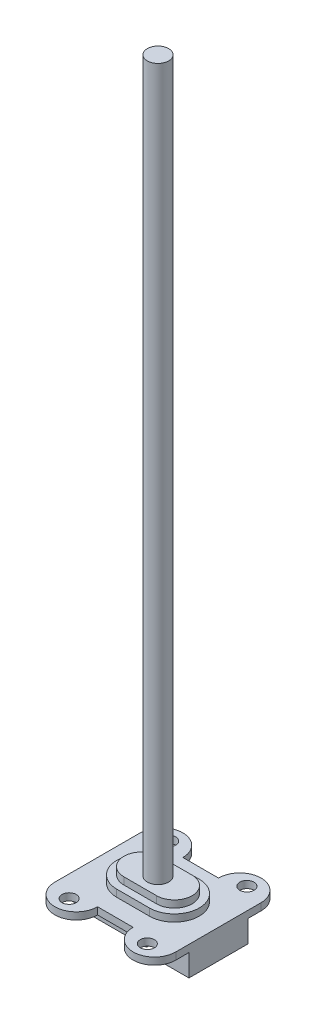
from build123d import *

# Parameters (mm, degrees)
SKETCH_1_W            = 17
SKETCH_1_H            = 18
EXTRUDE_1_DEPTH       = 1
SKETCH_2_R            = 1
CUT_EXTRUDE_1_DEPTH   = 13.419742348
CUT_EXTRUDE_2_DEPTH   = 13.419742348
MIRROR_2_COPY_1_DEPTH = 13.419742348
SKETCH_4_W            = 5
SKETCH_4_H            = 3
CUT_EXTRUDE_3_DEPTH   = 13.419742348
EXTRUDE_2_DEPTH       = 1
EXTRUDE_3_DEPTH       = 1
EXTRUDE_START         = 8.5
SKETCH_8_W            = 8.3
SKETCH_8_H            = 3.1
EXTRUDE_4_DEPTH       = 4.2
SKETCH_9_W            = 10.2
SKETCH_9_H            = 9
EXTRUDE_5_DEPTH       = 2
SKETCH_10_R           = 1.5
EXTRUDE_10_DEPTH      = 100


with BuildPart() as part:
    # 草图1 → 凸台-拉伸1 (new body)
    with BuildSketch(Plane(origin=(0, 0, 0), x_dir=(1, 0, 0), z_dir=(0, 1, 0))):
        Rectangle(SKETCH_1_W, SKETCH_1_H)
    extrude(amount=EXTRUDE_1_DEPTH)

    # 草图2 → 切除-拉伸1 (cut, through all)
    with BuildSketch(Plane(origin=(0, 1, 0), x_dir=(1, 0, 0), z_dir=(0, 1, 0))):
        with Locations(Location((-5.5, 7, 0), (0, 0, 270))):
            Circle(SKETCH_2_R)
        with Locations(Location((5.5, 7, 0), (0, 0, 270))):
            Circle(SKETCH_2_R)
        with Locations(Location((-5.5, -7, 0), (0, 0, 270))):
            Circle(SKETCH_2_R)
        with Locations(Location((5.5, -7, 0), (0, 0, 270))):
            Circle(SKETCH_2_R)
    extrude(amount=-CUT_EXTRUDE_1_DEPTH, mode=Mode.SUBTRACT)

    # 草图3 → 切除-拉伸2 (cut, through all)
    with BuildSketch(Plane(origin=(0, 1, 0), x_dir=(1, 0, 0), z_dir=(0, 1, 0))):
        with BuildLine():
            Line((-8.5, 9), (-8.5, 6))
            ThreePointArc((-8.5, 6), (-7.621320346, 8.121320341), (-5.500000007, 9))
            Line((-5.500000007, 9), (-8.5, 9))
        make_face()
        with BuildLine():
            Line((-2.5, 9), (-5.500000007, 9))
            ThreePointArc((-5.500000007, 9), (-3.378679659, 8.121320346), (-2.5, 6))
            Line((-2.5, 6), (-2.5, 9))
        make_face()
    cut_extrude_2 = extrude(amount=-CUT_EXTRUDE_2_DEPTH, mode=Mode.SUBTRACT)

    # 镜向1: 切除-拉伸2 across plane
    add(cut_extrude_2.mirror(Plane.XY), mode=Mode.SUBTRACT)

    # 镜向2: 切除-拉伸2 across plane
    add(cut_extrude_2.mirror(Plane(origin=(0, 0, 0), x_dir=(0, 0, 1), z_dir=(1, 0, 0))), mode=Mode.SUBTRACT)

    # 镜向2 copy 1 sketch → 镜向2 copy 1 (cut, through all)
    with BuildSketch(Plane(origin=(0, 1, 0), x_dir=(-1, 0, 0), z_dir=(0, 1, 0))):
        with BuildLine():
            Line((-8.5, 9), (-8.5, 6))
            ThreePointArc((-8.5, 6), (-7.621320346, 8.121320341), (-5.500000007, 9))
            Line((-5.500000007, 9), (-8.5, 9))
        make_face()
        with BuildLine():
            Line((-2.5, 9), (-5.500000007, 9))
            ThreePointArc((-5.500000007, 9), (-3.378679659, 8.121320346), (-2.5, 6))
            Line((-2.5, 6), (-2.5, 9))
        make_face()
    extrude(amount=-MIRROR_2_COPY_1_DEPTH, mode=Mode.SUBTRACT)

    # 草图4 → 切除-拉伸3 (cut, through all)
    with BuildSketch(Plane(origin=(0, 1, 0), x_dir=(1, 0, 0), z_dir=(0, 1, 0))):
        with Locations((0, 7.5)):
            Rectangle(SKETCH_4_W, SKETCH_4_H)
    cut_extrude_3 = extrude(amount=-CUT_EXTRUDE_3_DEPTH, mode=Mode.SUBTRACT)

    # 镜向3: 切除-拉伸3 across plane
    add(cut_extrude_3.mirror(Plane.XY), mode=Mode.SUBTRACT)

    # 草图5 → 凸台-拉伸2 (add)
    with BuildSketch(Plane(origin=(0, 1, 0), x_dir=(1, 0, 0), z_dir=(0, 1, 0))):
        with BuildLine():
            Line((0, 0), (-2.3, 3.5))
            ThreePointArc((-2.3, 3.5), (-5.8, 0), (-2.3, -3.5))
            Line((-2.3, -3.5), (0, 0))
        make_face()
        Polygon((2.3, 3.5), (-2.3, 3.5), (0, 0), align=None)
        Polygon((2.3, -3.5), (0, 0), (-2.3, -3.5), align=None)
        with BuildLine():
            ThreePointArc((2.3, -3.5), (5.8, 0), (2.3, 3.5))
            Line((2.3, 3.5), (0, 0))
            Line((0, 0), (2.3, -3.5))
        make_face()
    extrude(amount=EXTRUDE_2_DEPTH)

    # 草图6 → 凸台-拉伸3 (add)
    with BuildSketch(Plane(origin=(0, 2, 0), x_dir=(1, 0, 0), z_dir=(0, 1, 0))):
        with BuildLine():
            Line((0, 0), (-2.3, 2.5))
            ThreePointArc((-2.3, 2.5), (-4.8, 0), (-2.3, -2.5))
            Line((-2.3, -2.5), (0, 0))
        make_face()
        Polygon((2.3, 2.5), (-2.3, 2.5), (0, 0), align=None)
        Polygon((2.3, -2.5), (0, 0), (-2.3, -2.5), align=None)
        with BuildLine():
            ThreePointArc((2.3, -2.5), (4.8, 0), (2.3, 2.5))
            Line((2.3, 2.5), (0, 0))
            Line((0, 0), (2.3, -2.5))
        make_face()
    extrude(amount=EXTRUDE_3_DEPTH)

    # 草图8 → 凸台-拉伸4 (add)
    with BuildSketch(Plane(origin=(0, 0, 0), x_dir=(0, 0, -1), z_dir=(1, 0, 0)).offset(EXTRUDE_START)):
        with Locations((0, -1.55)):
            Rectangle(SKETCH_8_W, SKETCH_8_H)
    extrude(amount=-EXTRUDE_4_DEPTH)

    # 草图9 → 凸台-拉伸5 (add)
    with BuildSketch(Plane.XZ):
        with Locations((-2.21638326, 0)):
            Rectangle(SKETCH_9_W, SKETCH_9_H)
    extrude(amount=EXTRUDE_5_DEPTH)

    # 草图10 → 凸台-拉伸10 (add)
    with BuildSketch(Plane(origin=(0, 3, 0), x_dir=(1, 0, 0), z_dir=(0, 1, 0))):
        with Locations(Location((0, 0, 0), (0, 0, 270))):
            Circle(SKETCH_10_R)
    extrude(amount=EXTRUDE_10_DEPTH)


solid = part.part
